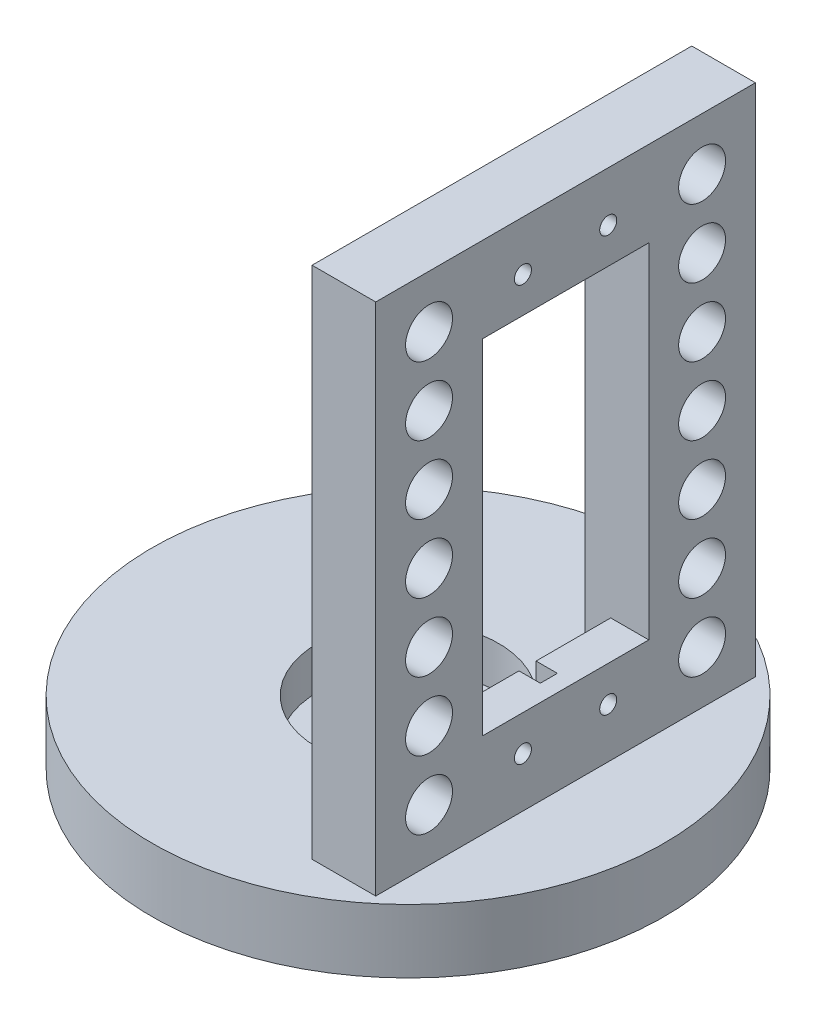
from build123d import *

# Parameters (mm, degrees)
SKETCH1_R           = 30
SKETCH1_R_2         = 1
SKETCH1_R_3         = 4.9
BOSS_EXTRUDE1_DEPTH = 7.46
SKETCH3_W           = 7.46
SKETCH3_H           = 44.5
BOSS_EXTRUDE2_DEPTH = 60.3
SKETCH4_R           = 1
SKETCH4_W           = 19.5
SKETCH4_H           = 40.3
CUT_EXTRUDE2_DEPTH  = 85.690126933
SKETCH5_R           = 10.6
CUT_EXTRUDE3_DEPTH  = 4.96
SKETCH6_W           = 19.5
SKETCH6_H           = 54
CUT_EXTRUDE4_DEPTH  = 3
SKETCH7_W           = 2
SKETCH7_H           = 6.85
CUT_EXTRUDE5_DEPTH  = 2.5
SKETCH8_R           = 2.75
CUT_EXTRUDE6_DEPTH  = 85.690126933


with BuildPart() as part:
    # Sketch1 → Boss-Extrude1 (new body)
    with BuildSketch(Plane(origin=(0, 0, 0), x_dir=(1, 0, 0), z_dir=(0, 1, 0))):
        with Locations(Location((0, 0, 0), (0, 0, 90))):
            Circle(SKETCH1_R)
        with Locations(Location((7, 0, 0), (0, 0, 90))):
            Circle(SKETCH1_R_2, mode=Mode.SUBTRACT)
        with Locations(Location((0, -7, 0), (0, 0, 90))):
            Circle(SKETCH1_R_2, mode=Mode.SUBTRACT)
        with Locations(Location((-7, 0, 0), (0, 0, 90))):
            Circle(SKETCH1_R_2, mode=Mode.SUBTRACT)
        with Locations(Location((0, 7, 0), (0, 0, 90))):
            Circle(SKETCH1_R_2, mode=Mode.SUBTRACT)
        with Locations(Location((0, 0, 0), (0, 0, 90))):
            Circle(SKETCH1_R_3, mode=Mode.SUBTRACT)
    extrude(amount=BOSS_EXTRUDE1_DEPTH)

    # Sketch3 → Boss-Extrude2 (add)
    with BuildSketch(Plane(origin=(0, 7.46, 0), x_dir=(1, 0, 0), z_dir=(0, 1, 0))):
        with Locations((14.73, 0)):
            Rectangle(SKETCH3_W, SKETCH3_H)
    extrude(amount=BOSS_EXTRUDE2_DEPTH)

    # Sketch4 → Cut-Extrude2 (cut, through all)
    with BuildSketch(Plane.ZY.offset(-11)):
        with Locations((-5, 61.93)):
            Circle(SKETCH4_R)
        with Locations((5, 61.93)):
            Circle(SKETCH4_R)
        with Locations((5, 13.29)):
            Circle(SKETCH4_R)
        with Locations((-5, 13.29)):
            Circle(SKETCH4_R)
        with Locations((0, 37.61)):
            Rectangle(SKETCH4_W, SKETCH4_H)
    extrude(amount=-CUT_EXTRUDE2_DEPTH, mode=Mode.SUBTRACT)

    # Sketch5 → Cut-Extrude3 (cut)
    with BuildSketch(Plane(origin=(0, 7.46, 0), x_dir=(1, 0, 0), z_dir=(0, 1, 0))):
        with Locations(Location((0, 0, 0), (0, 0, 270))):
            Circle(SKETCH5_R)
    extrude(amount=-CUT_EXTRUDE3_DEPTH, mode=Mode.SUBTRACT)

    # Sketch6 → Cut-Extrude4 (cut)
    with BuildSketch(Plane.ZY.offset(-11)):
        with Locations((0, 37.61)):
            Rectangle(SKETCH6_W, SKETCH6_H)
    extrude(amount=-CUT_EXTRUDE4_DEPTH, mode=Mode.SUBTRACT)

    # Sketch7 → Cut-Extrude5 (cut)
    with BuildSketch(Plane.ZY.offset(-14)):
        with Locations((0, 61.185)):
            Rectangle(SKETCH7_W, SKETCH7_H)
        with Locations((0, 14.035)):
            Rectangle(SKETCH7_W, SKETCH7_H)
    extrude(amount=-CUT_EXTRUDE5_DEPTH, mode=Mode.SUBTRACT)

    # Sketch8 → Cut-Extrude6 (cut, through all)
    with BuildSketch(Plane.ZY.offset(-11)):
        with Locations((-16, 37.61)):
            Circle(SKETCH8_R)
        with Locations((-16, 45.61)):
            Circle(SKETCH8_R)
        with Locations((-16, 53.61)):
            Circle(SKETCH8_R)
        with Locations((-16, 61.61)):
            Circle(SKETCH8_R)
        with Locations((-16, 13.61)):
            Circle(SKETCH8_R)
        with Locations((-16, 21.61)):
            Circle(SKETCH8_R)
        with Locations((-16, 29.61)):
            Circle(SKETCH8_R)
        with Locations((16, 29.61)):
            Circle(SKETCH8_R)
        with Locations((16, 21.61)):
            Circle(SKETCH8_R)
        with Locations((16, 13.61)):
            Circle(SKETCH8_R)
        with Locations((16, 61.61)):
            Circle(SKETCH8_R)
        with Locations((16, 53.61)):
            Circle(SKETCH8_R)
        with Locations((16, 45.61)):
            Circle(SKETCH8_R)
        with Locations((16, 37.61)):
            Circle(SKETCH8_R)
    extrude(amount=-CUT_EXTRUDE6_DEPTH, mode=Mode.SUBTRACT)


solid = part.part
